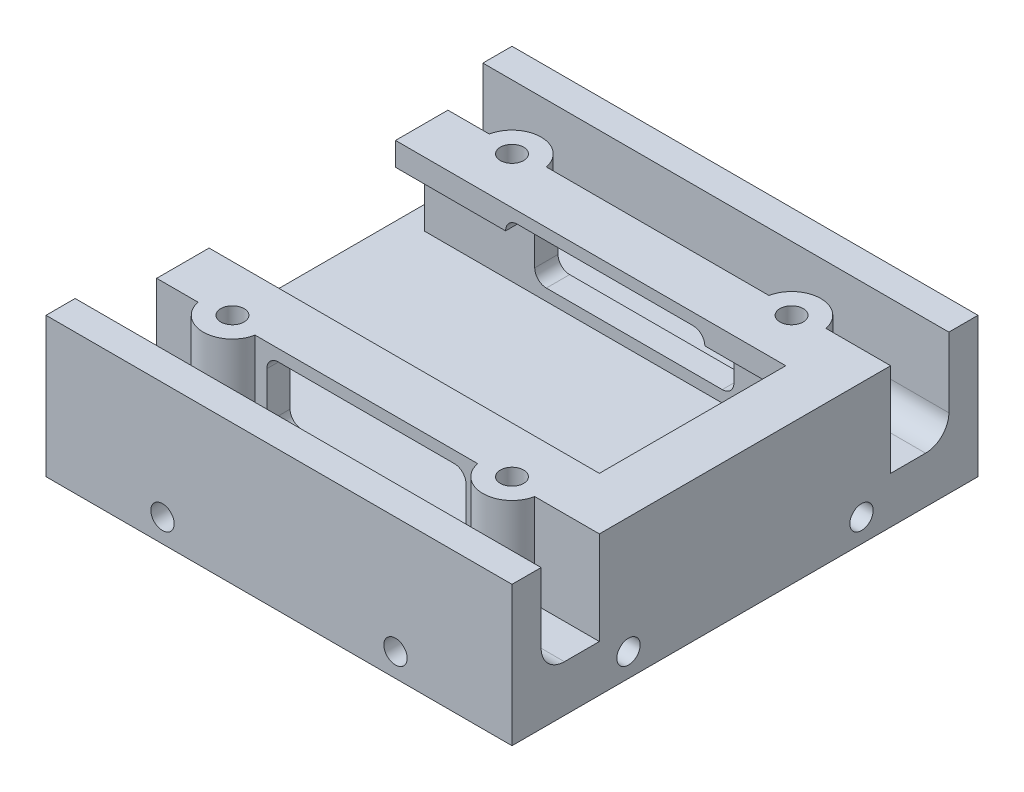
from build123d import *

# Parameters (mm, degrees)
SKETCH1_W            = 40
SKETCH1_H            = 40
BOSS_EXTRUDE3_DEPTH  = 2
BOSS_EXTRUDE4_DEPTH  = 6
BOSS_EXTRUDE5_DEPTH  = 2
BOSS_EXTRUDE6_START  = -6
BOSS_EXTRUDE6_DEPTH  = 6
BOSS_EXTRUDE7_DEPTH  = 2
SKETCH7_R            = 1
CUT_EXTRUDE1_DEPTH   = 5
CUT_EXTRUDE2_DEPTH   = 34
BOSS_EXTRUDE8_DEPTH  = 8
BOSS_EXTRUDE9_DEPTH  = 40
SKETCH11_W           = 40
SKETCH11_H           = 40
BOSS_EXTRUDE10_DEPTH = 2
SKETCH13_R           = 1
CUT_EXTRUDE3_DEPTH   = 5
CIRPATTERN1_COUNT    = 4


with BuildPart() as part:
    # Sketch1 → Boss-Extrude3 (new body)
    with BuildSketch(Plane(origin=(0, 0, 0), x_dir=(1, 0, 0), z_dir=(0, 1, 0))):
        Rectangle(SKETCH1_W, SKETCH1_H)
    extrude(amount=BOSS_EXTRUDE3_DEPTH)

    # Sketch5 → Boss-Extrude4 (add)
    with BuildSketch(Plane(origin=(0, 2, 0), x_dir=(1, 0, 0), z_dir=(0, 1, 0))):
        Polygon((18, -10.5), (-18, -10.5), (-18, -12.5), (20, -12.5), (20, 12.5), (-18, 12.5), (-18, 10.5), (18, 10.5), align=None)
    extrude(amount=BOSS_EXTRUDE4_DEPTH)

    # Sketch6 → Boss-Extrude5 (add)
    with BuildSketch(Plane(origin=(0, 8, 0), x_dir=(1, 0, 0), z_dir=(0, 1, 0))):
        with BuildLine():
            ThreePointArc((14, -10.5), (12, -9.5), (10, -10.5))
            Line((10, -10.5), (-10, -10.5))
            ThreePointArc((-10, -10.5), (-12, -9.5), (-14, -10.5))
            Line((-14, -10.5), (-18, -10.5))
            Line((-18, -10.5), (-18, -12.5))
            Line((-18, -12.5), (-14.449489743, -12.5))
            ThreePointArc((-14.449489743, -12.5), (-12, -14.5), (-9.550510257, -12.5))
            Line((-9.550510257, -12.5), (9.550510257, -12.5))
            ThreePointArc((9.550510257, -12.5), (12, -14.5), (14.449489743, -12.5))
            Line((14.449489743, -12.5), (20, -12.5))
            Line((20, -12.5), (20, 12.5))
            Line((20, 12.5), (14.449489743, 12.5))
            ThreePointArc((14.449489743, 12.5), (12, 14.5), (9.550510257, 12.5))
            Line((9.550510257, 12.5), (-9.550510257, 12.5))
            ThreePointArc((-9.550510257, 12.5), (-12, 14.5), (-14.449489743, 12.5))
            Line((-14.449489743, 12.5), (-18, 12.5))
            Line((-18, 12.5), (-18, 10.5))
            Line((-18, 10.5), (-14, 10.5))
            ThreePointArc((-14, 10.5), (-12, 9.5), (-10, 10.5))
            Line((-10, 10.5), (10, 10.5))
            ThreePointArc((10, 10.5), (12, 9.5), (14, 10.5))
            Line((14, 10.5), (18, 10.5))
            Line((18, 10.5), (18, -10.5))
            Line((18, -10.5), (14, -10.5))
        make_face()
    extrude(amount=BOSS_EXTRUDE5_DEPTH)

    # Sketch6<3> → Boss-Extrude6 (add)
    with BuildSketch(Plane(origin=(0, 8, 0), x_dir=(1, 0, 0), z_dir=(0, 1, 0)).offset(BOSS_EXTRUDE6_START)):
        with BuildLine():
            ThreePointArc((-9.550510257, 12.5), (-12, 14.5), (-14.449489743, 12.5))
            Line((-14.449489743, 12.5), (-9.550510257, 12.5))
        make_face()
        with BuildLine():
            ThreePointArc((14.449489743, 12.5), (12, 14.5), (9.550510257, 12.5))
            Line((9.550510257, 12.5), (14.449489743, 12.5))
        make_face()
        with BuildLine():
            Line((-9.550510257, -12.5), (-14.449489743, -12.5))
            ThreePointArc((-14.449489743, -12.5), (-12, -14.5), (-9.550510257, -12.5))
        make_face()
        with BuildLine():
            ThreePointArc((9.550510257, -12.5), (12, -14.5), (14.449489743, -12.5))
            Line((14.449489743, -12.5), (9.550510257, -12.5))
        make_face()
    extrude(amount=BOSS_EXTRUDE6_DEPTH)

    # Sketch6<4> → Boss-Extrude7 (add)
    with BuildSketch(Plane(origin=(0, 8, 0), x_dir=(1, 0, 0), z_dir=(0, 1, 0))):
        with BuildLine():
            Line((-15.5, -8), (-18, -8))
            Line((-18, -8), (-18, -10.5))
            Line((-18, -10.5), (-14, -10.5))
            ThreePointArc((-14, -10.5), (-13.118033989, -9.763932023), (-12, -9.5))
            Line((-12, -9.5), (-12, -8))
            Line((-12, -8), (-15.5, -8))
        make_face()
        with BuildLine():
            Line((12, -8), (-12, -8))
            Line((-12, -8), (-12, -9.5))
            ThreePointArc((-12, -9.5), (-10.881966011, -9.763932023), (-10, -10.5))
            Line((-10, -10.5), (10, -10.5))
            ThreePointArc((10, -10.5), (10.881966011, -9.763932023), (12, -9.5))
            Line((12, -9.5), (12, -8))
        make_face()
        with BuildLine():
            Line((12, 9.5), (12, 8))
            Line((12, 8), (15.5, 8))
            Line((15.5, 8), (15.5, -8))
            Line((15.5, -8), (12, -8))
            Line((12, -8), (12, -9.5))
            ThreePointArc((12, -9.5), (13.118033989, -9.763932023), (14, -10.5))
            Line((14, -10.5), (18, -10.5))
            Line((18, -10.5), (18, 10.5))
            Line((18, 10.5), (14, 10.5))
            ThreePointArc((14, 10.5), (13.118033989, 9.763932023), (12, 9.5))
        make_face()
        with BuildLine():
            ThreePointArc((-10, 10.5), (-10.881966011, 9.763932023), (-12, 9.5))
            Line((-12, 9.5), (-12, 8))
            Line((-12, 8), (12, 8))
            Line((12, 8), (12, 9.5))
            ThreePointArc((12, 9.5), (10.881966011, 9.763932023), (10, 10.5))
            Line((10, 10.5), (-10, 10.5))
        make_face()
        with BuildLine():
            Line((-14, 10.5), (-18, 10.5))
            Line((-18, 10.5), (-18, 8))
            Line((-18, 8), (-15.5, 8))
            Line((-15.5, 8), (-12, 8))
            Line((-12, 8), (-12, 9.5))
            ThreePointArc((-12, 9.5), (-13.118033989, 9.763932023), (-14, 10.5))
        make_face()
    extrude(amount=BOSS_EXTRUDE7_DEPTH)

    # Sketch7 → Cut-Extrude1 (cut)
    with BuildSketch(Plane(origin=(0, 10, 0), x_dir=(1, 0, 0), z_dir=(0, 1, 0))):
        with Locations(Location((-12, 12, 0), (0, 0, 270))):
            Circle(SKETCH7_R)
        with Locations(Location((12, 12, 0), (0, 0, 270))):
            Circle(SKETCH7_R)
        with Locations(Location((12, -12, 0), (0, 0, 270))):
            Circle(SKETCH7_R)
        with Locations(Location((-12, -12, 0), (0, 0, 270))):
            Circle(SKETCH7_R)
    extrude(amount=-CUT_EXTRUDE1_DEPTH, mode=Mode.SUBTRACT)

    # Sketch8 → Cut-Extrude2 (cut)
    with BuildSketch(Plane.XY.offset(12.5)):
        with BuildLine():
            ThreePointArc((-8.550510257, 8), (-8.257617038, 8.707106781), (-7.550510257, 9))
            Line((-7.550510257, 9), (7.550510257, 9))
            ThreePointArc((7.550510257, 9), (8.257617038, 8.707106781), (8.550510257, 8))
            Line((8.550510257, 8), (8.550510257, 4))
            ThreePointArc((8.550510257, 4), (8.257617038, 3.292893219), (7.550510257, 3))
            Line((7.550510257, 3), (-7.550510257, 3))
            ThreePointArc((-7.550510257, 3), (-8.257617038, 3.292893219), (-8.550510257, 4))
            Line((-8.550510257, 4), (-8.550510257, 8))
        make_face()
    extrude(amount=-CUT_EXTRUDE2_DEPTH, mode=Mode.SUBTRACT)

    # Sketch9 → Boss-Extrude8 (add)
    with BuildSketch(Plane(origin=(0, 2, 0), x_dir=(1, 0, 0), z_dir=(0, 1, 0))):
        Polygon((-20, 20), (-20, 17.5), (-17.5, 17.5), (17.5, 17.5), (20, 17.5), (20, 20), align=None)
        Polygon((-17.5, -17.5), (-20, -17.5), (-20, -20), (20, -20), (20, -17.5), (17.5, -17.5), align=None)
    extrude(amount=BOSS_EXTRUDE8_DEPTH)

    # Sketch10 → Boss-Extrude9 (add)
    with BuildSketch(Plane.ZY.offset(20)):
        with BuildLine():
            Line((-17.5, 2), (-15.5, 2))
            ThreePointArc((-15.5, 2), (-16.914213562, 2.585786438), (-17.5, 4))
            Line((-17.5, 4), (-17.5, 2))
        make_face()
        with BuildLine():
            ThreePointArc((17.5, 4), (16.914213562, 2.585786438), (15.5, 2))
            Line((15.5, 2), (17.5, 2))
            Line((17.5, 2), (17.5, 4))
        make_face()
    extrude(amount=-BOSS_EXTRUDE9_DEPTH)

    # Sketch11 → Boss-Extrude10 (add)
    with BuildSketch(Plane.XZ):
        Rectangle(SKETCH11_W, SKETCH11_H)
    extrude(amount=BOSS_EXTRUDE10_DEPTH)

    # Sketch13 → Cut-Extrude3 (cut)
    with BuildSketch(Plane(origin=(20, 0, 0), x_dir=(0, 0, -1), z_dir=(1, 0, 0))):
        with Locations((-10, 0)):
            Circle(SKETCH13_R)
        with Locations(Location((10, 0, 0), (0, 0, 180))):
            Circle(SKETCH13_R)
    cut_extrude3 = extrude(amount=-CUT_EXTRUDE3_DEPTH, mode=Mode.SUBTRACT)

    # CirPattern1: Cut-Extrude3 ×4 about axis
    cirpattern1_axis = Axis((0, 0, 0), (0, 1, 0))
    for i in range(1, CIRPATTERN1_COUNT):
        add(cut_extrude3.rotate(cirpattern1_axis, i * 360 / CIRPATTERN1_COUNT), mode=Mode.SUBTRACT)


solid = part.part
